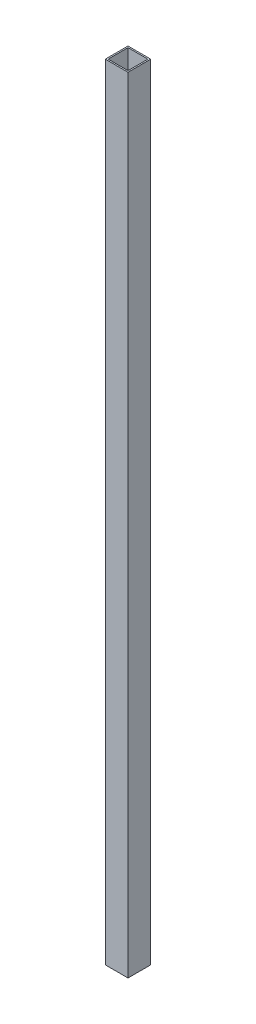
from build123d import *

# Parameters (mm, degrees)
SKETCH1_W           = 25.4
SKETCH1_H           = 25.4
SKETCH1_W_2         = 22.225
SKETCH1_H_2         = 22.225
BOSS_EXTRUDE1_DEPTH = 876.3


with BuildPart() as part:
    # Sketch1 → Boss-Extrude1 (new body)
    with BuildSketch(Plane(origin=(0, 0, 0), x_dir=(1, 0, 0), z_dir=(0, 1, 0))):
        Rectangle(SKETCH1_W, SKETCH1_H)
        Rectangle(SKETCH1_W_2, SKETCH1_H_2, mode=Mode.SUBTRACT)
    extrude(amount=BOSS_EXTRUDE1_DEPTH)


solid = part.part
